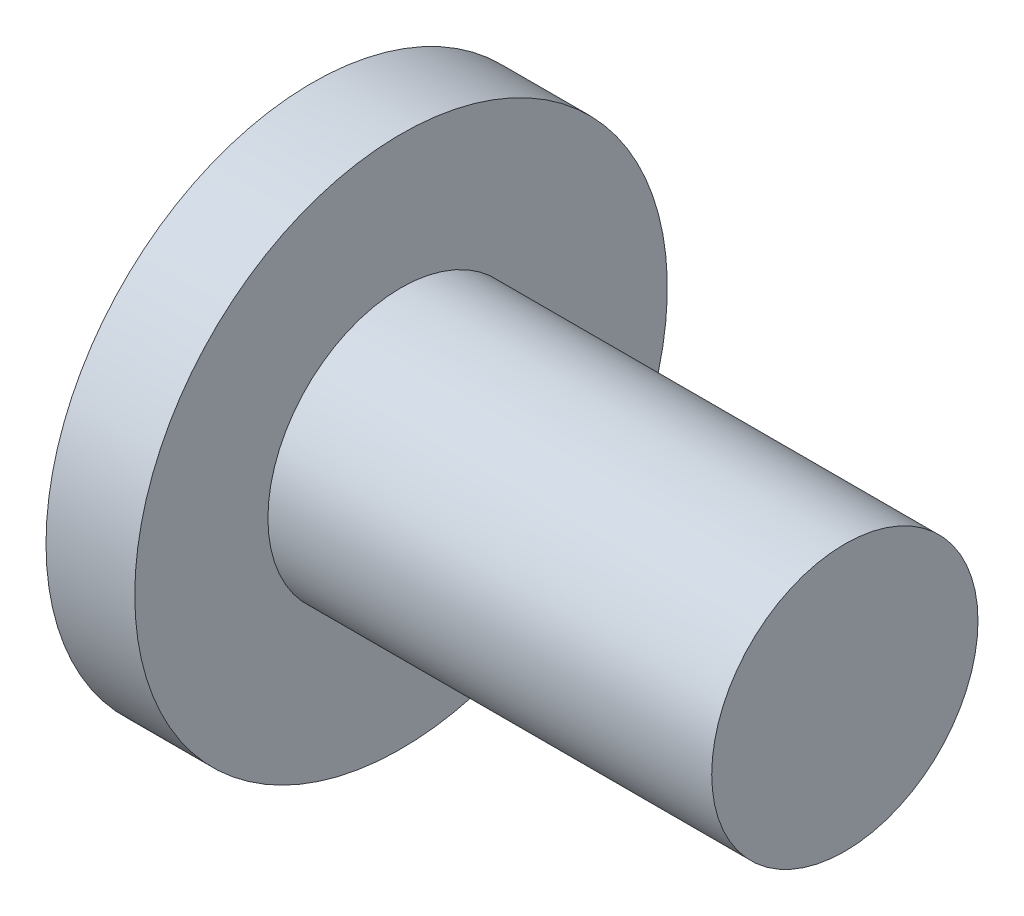
from build123d import *


with BuildPart() as part:
    # Çizim1 → Döndür1 (revolve)
    with BuildSketch(Plane.XY, mode=Mode.PRIVATE) as d_nd_r1_sk:
        Polygon((0, 0), (0, 3), (-10, 3), (-10, 6), (-12, 6), (-12, 0), align=None)
    revolve(d_nd_r1_sk.sketch.rotate(Axis((-12, 0, 0), (1, 0, 0)), 90), axis=Axis((-12, 0, 0), (1, 0, 0)))


solid = part.part
